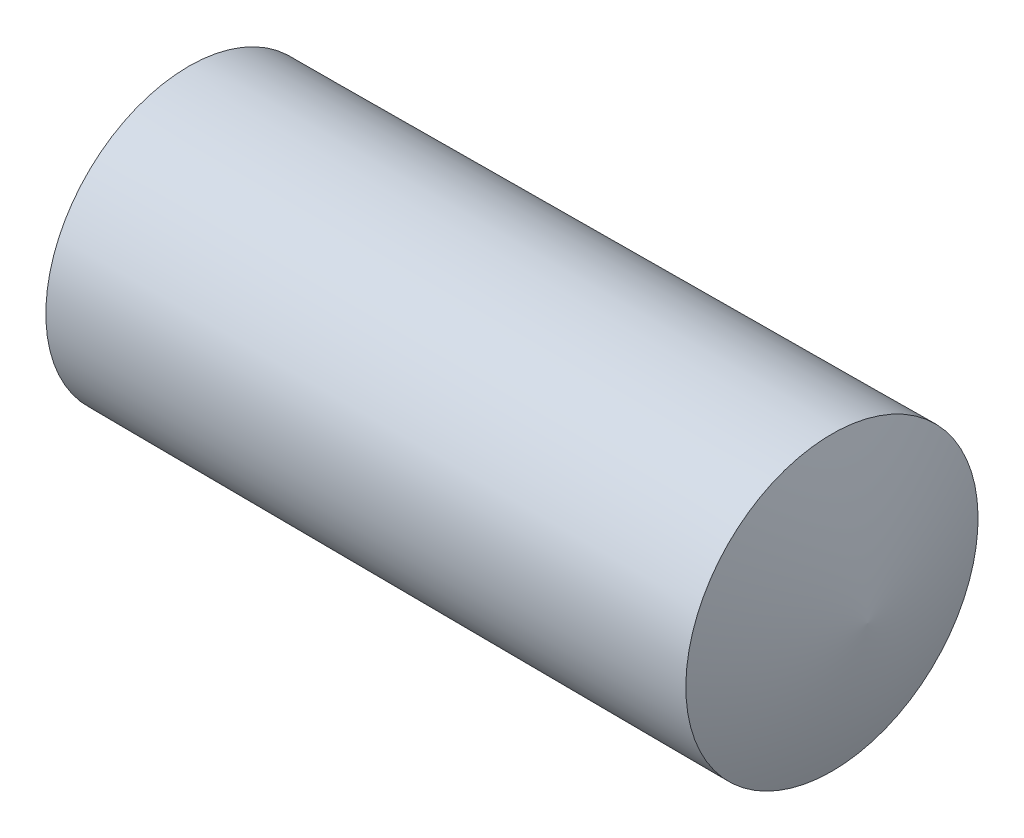
from build123d import *


with BuildPart() as part:
    # 草图1 → Revolve 599 (revolve)
    with BuildSketch(Plane.XY):
        with BuildLine():
            Line((-2.82, 0), (7.18, 0))
            ThreePointArc((7.18, 0), (6.995381402, -1.038195673), (6.68, -2.044410786))
            Line((6.68, -2.044410786), (-2.32, -2))
            ThreePointArc((-2.32, -2), (-2.634693151, -1.016173288), (-2.82, 0))
        make_face()
    revolve(axis=Axis((0, 0, 0), (1, 0, 0)))


solid = part.part
